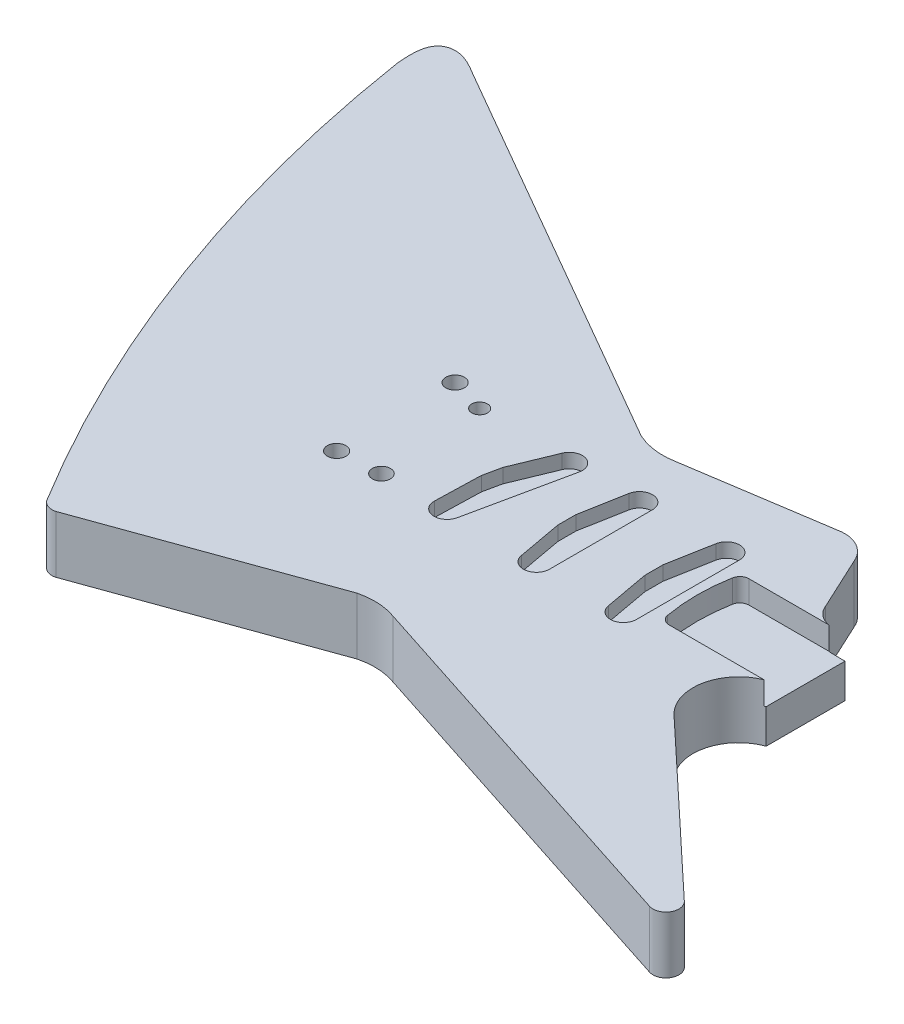
from build123d import *

# Parameters (mm, degrees)
BOSS_EXTRUDE1_DEPTH            = 40
F_13_0_13_DIAMETER_HOLE1_D     = 13
F_13_0_13_DIAMETER_HOLE1_DEPTH = 29
CUT_EXTRUDE8_DEPTH             = 16
SKETCH14_R                     = 6.35
SKETCH14_R_2                   = 5.502637429
CUT_EXTRUDE9_DEPTH             = 10
CUT_EXTRUDE10_DEPTH            = 10


with BuildPart() as part:
    # Sketch1 → Boss-Extrude1 (new body)
    with BuildSketch(Plane(origin=(0, 20, 0), x_dir=(1, 0, 0), z_dir=(0, 1, 0))):
        with BuildLine():
            Line((563.96485174, 507.513718698), (563.96485174, 562.736423486))
            Line((563.96485174, 562.736423486), (554.690781869, 562.894803628))
            ThreePointArc((554.690781869, 562.894803628), (545.704943994, 565.795150829), (539.853906856, 573.206133263))
            Line((539.853906856, 573.206133263), (522.524343645, 610.429990226))
            ThreePointArc((522.524343645, 610.429990226), (512.649800976, 621.543175495), (497.931198247, 623.634159339))
            Line((497.931198247, 623.634159339), (399.830947056, 608.608698386))
            ThreePointArc((399.830947056, 608.608698386), (385.610832142, 608.137408426), (371.923585817, 612.02238853))
            Line((371.923585817, 612.02238853), (95.310746964, 771.494097008))
            add(Edge.make_bspline(
                [(60.287007155, 752.902507236), (59.408683029, 762.769524202), (58.560960325, 776.204376236), (76.94287295, 783.298520304), (86.753146937, 776.493697586), (95.310746964, 771.494097008)],
                knots=[0, 0, 0, 0, 0.5, 0.5, 1, 1, 1, 1], degree=3))
            ThreePointArc((60.287007155, 752.902507236), (112.407005996, 551.803928099), (202.762947005, 364.739937083))
            ThreePointArc((202.762947005, 364.739937083), (207.132055784, 361.391783138), (212.632195034, 361.173346422))
            Line((212.632195034, 361.173346422), (367.65464082, 417.084401042))
            ThreePointArc((367.65464082, 417.084401042), (380.966681082, 418.419109504), (394.090964942, 415.82198883))
            Line((394.090964942, 415.82198883), (660.231475403, 329.574923038))
            ThreePointArc((660.231475403, 329.574923038), (670.878462163, 333.606992627), (669.266978502, 344.877264703))
            Line((669.266978502, 344.877264703), (553.73117364, 453.239940989))
            ThreePointArc((553.73117364, 453.239940989), (543.342125743, 483.300566911), (563.96485174, 507.513718698))
        make_face()
    extrude(amount=-BOSS_EXTRUDE1_DEPTH)

    # Ø13.0 (13) Diameter Hole1
    with Locations(Plane(origin=(0, 20, 0), x_dir=(1, 0, 0), z_dir=(0, 1, 0))):
        with Locations((274.335910331, 496.233480955), (274.335910331, 579.213058938)):
            Hole(F_13_0_13_DIAMETER_HOLE1_D / 2, depth=F_13_0_13_DIAMETER_HOLE1_DEPTH)

    # Sketch13 → Cut-Extrude8 (cut)
    with BuildSketch(Plane(origin=(0, 20, 0), x_dir=(1, 0, 0), z_dir=(0, 1, 0))):
        with BuildLine():
            Line((563.96485174, 563.125071092), (496.273234513, 563.125071092))
            ThreePointArc((496.273234513, 563.125071092), (492.20587406, 561.651450789), (490.026307291, 557.914544776))
            ThreePointArc((490.026307291, 557.914544776), (487.96485174, 535.125071092), (490.026307291, 512.335597408))
            ThreePointArc((490.026307291, 512.335597408), (492.20587406, 508.598691395), (496.273234513, 507.125071092))
            Line((496.273234513, 507.125071092), (563.96485174, 507.125071092))
            Line((563.96485174, 507.125071092), (563.96485174, 563.125071092))
        make_face()
    extrude(amount=-CUT_EXTRUDE8_DEPTH, mode=Mode.SUBTRACT)

    # Sketch14 → Cut-Extrude9 (cut)
    with BuildSketch(Plane(origin=(0, 20, 0), x_dir=(1, 0, 0), z_dir=(0, 1, 0))):
        with Locations(Location((303.81485174, 498.131405852, 0), (0, 0, 270))):
            Circle(SKETCH14_R)
        with Locations(Location((298.641153596, 572.118736332, 0), (0, 0, 270))):
            Circle(SKETCH14_R_2)
    extrude(amount=-CUT_EXTRUDE9_DEPTH, mode=Mode.SUBTRACT)

    # Sketch17 → Cut-Extrude10 (cut)
    with BuildSketch(Plane(origin=(0, 20, 0), x_dir=(1, 0, 0), z_dir=(0, 1, 0))):
        with BuildLine():
            Line((481.61485174, 499.042173829), (481.61485174, 571.207968354))
            ThreePointArc((481.61485174, 571.207968354), (473.296544122, 580.314612527), (463.475969831, 572.852606745))
            Line((463.475969831, 572.852606745), (457.73885174, 541.475071092))
            Line((457.73885174, 541.475071092), (457.73885174, 528.775071092))
            Line((457.73885174, 528.775071092), (463.475969831, 497.397535439))
            ThreePointArc((463.475969831, 497.397535439), (473.296544122, 489.935529657), (481.61485174, 499.042173829))
        make_face()
        with BuildLine():
            Line((420.65485174, 499.042173829), (420.65485174, 571.207968354))
            ThreePointArc((420.65485174, 571.207968354), (412.336544122, 580.314612527), (402.515969831, 572.852606745))
            Line((402.515969831, 572.852606745), (396.77885174, 541.475071092))
            Line((396.77885174, 541.475071092), (396.77885174, 528.775071092))
            Line((396.77885174, 528.775071092), (402.515969831, 497.397535439))
            ThreePointArc((402.515969831, 497.397535439), (412.336544122, 489.935529657), (420.65485174, 499.042173829))
        make_face()
        with BuildLine():
            Line((357.072977222, 497.929527206), (372.077089581, 568.518325976))
            ThreePointArc((372.077089581, 568.518325976), (365.83393473, 579.155441526), (354.67652531, 573.898310679))
            Line((354.67652531, 573.898310679), (342.541020523, 544.399263386))
            Line((342.541020523, 544.399263386), (339.90054205, 531.976788856))
            Line((339.90054205, 531.976788856), (338.988533854, 500.092113718))
            ThreePointArc((338.988533854, 500.092113718), (347.043066796, 490.751358459), (357.072977222, 497.929527206))
        make_face()
    extrude(amount=-CUT_EXTRUDE10_DEPTH, mode=Mode.SUBTRACT)


solid = part.part
